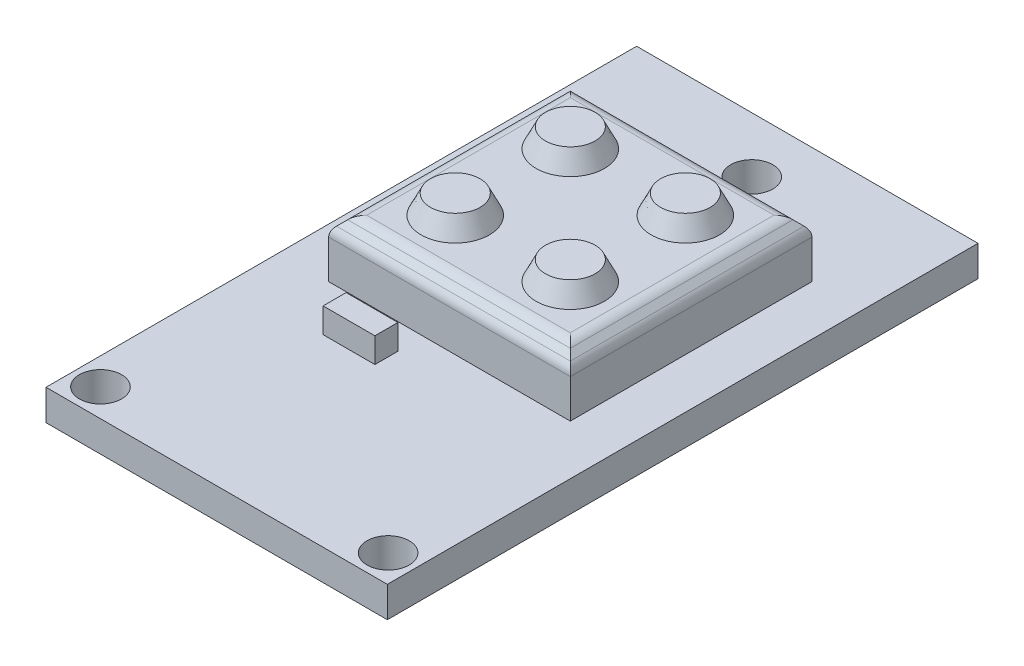
from build123d import *

# Parameters (mm, degrees)
SKETCH1_W           = 12.6
SKETCH1_H           = 12.6
BOSS_EXTRUDE1_DEPTH = 1.3
SKETCH3_R           = 1.29375
BOSS_EXTRUDE3_DEPTH = 2.7
DRAFT1_ANGLE        = 26
SKETCH4_W           = 12.6
SKETCH4_H           = 12.6
BOSS_EXTRUDE4_DEPTH = 1.7
SKETCH5_W           = 17.8
SKETCH5_H           = 30.8
BOSS_EXTRUDE5_DEPTH = 1.6
FILLET1_SIZE        = 0.7
SKETCH7_R           = 1.1
CUT_EXTRUDE1_DEPTH  = 36.933549783
SKETCH8_W           = 2.7
SKETCH8_H           = 1.2
CAPACITOR_DEPTH     = 1.3
FILLET5_R           = 0.7


with BuildPart() as part:
    # Sketch1 → Boss-Extrude1 (new body)
    with BuildSketch(Plane(origin=(0, 0, 0), x_dir=(1, 0, 0), z_dir=(0, 1, 0))):
        with Locations((9, 18.54)):
            Rectangle(SKETCH1_W, SKETCH1_H)
    extrude(amount=BOSS_EXTRUDE1_DEPTH)

    # Sketch3 → Boss-Extrude3 (add)
    with BuildSketch(Plane(origin=(0, 1.3, 0), x_dir=(1, 0, 0), z_dir=(0, 1, 0))):
        with Locations(Location((6, 21.54, 0), (0, 0, 90))):
            Circle(SKETCH3_R)
        with Locations(Location((12, 21.54, 0), (0, 0, 90))):
            Circle(SKETCH3_R)
        with Locations(Location((12, 15.54, 0), (0, 0, 90))):
            Circle(SKETCH3_R)
        with Locations(Location((6, 15.54, 0), (0, 0, 90))):
            Circle(SKETCH3_R)
    extrude(amount=BOSS_EXTRUDE3_DEPTH)

    # Draft1
    draft1_faces = [part.faces().sort_by_distance(p)[0] for p in [
        (6, 2.65, -14.24625),
        (12, 2.65, -14.24625),
        (12, 2.65, -20.24625),
        (6, 2.65, -20.24625),
    ]]
    draft(draft1_faces, Plane(origin=(6, 4, -21.54), x_dir=(0, 0, 1), z_dir=(0, 1, 0)), DRAFT1_ANGLE)

    # Sketch4 → Boss-Extrude4 (add)
    with BuildSketch(Plane(origin=(0, 1.3, 0), x_dir=(1, 0, 0), z_dir=(0, 1, 0))):
        with Locations((9, 18.54)):
            Rectangle(SKETCH4_W, SKETCH4_H)
    extrude(amount=BOSS_EXTRUDE4_DEPTH)

    # Sketch5 → Boss-Extrude5 (add)
    with BuildSketch(Plane.XZ):
        with Locations((9, -15.5)):
            Rectangle(SKETCH5_W, SKETCH5_H)
    extrude(amount=BOSS_EXTRUDE5_DEPTH)

    # Fillet1
    fillet1_edges = [part.edges().sort_by_distance(p)[0] for p in [
        (2.7, 3, -18.54),
        (9, 3, -12.24),
        (15.3, 3, -18.54),
        (9, 3, -24.84),
    ]]
    chamfer(fillet1_edges, length=FILLET1_SIZE)

    # Sketch7 → Cut-Extrude1 (cut, through all)
    with BuildSketch(Plane(origin=(0, 0, 0), x_dir=(1, 0, 0), z_dir=(0, 1, 0))):
        with Locations(Location((1.5, 1.54, 0), (0, 0, 270))):
            Circle(SKETCH7_R)
        with Locations(Location((9, 28, 0), (0, 0, 270))):
            Circle(SKETCH7_R)
        with Locations(Location((16.5, 1.54, 0), (0, 0, 270))):
            Circle(SKETCH7_R)
    extrude(amount=-CUT_EXTRUDE1_DEPTH, mode=Mode.SUBTRACT)

    # Sketch8 → capacitor (add)
    with BuildSketch(Plane(origin=(0, 0, 0), x_dir=(1, 0, 0), z_dir=(0, 1, 0))):
        with Locations((6.3, 10.3)):
            Rectangle(SKETCH8_W, SKETCH8_H)
    extrude(amount=CAPACITOR_DEPTH)

    # Fillet5
    fillet5_edges = [part.edges().sort_by_distance(p)[0] for p in [
        (3.4, 3, -18.54),
        (9, 3, -24.14),
        (14.6, 3, -18.54),
        (9, 3, -12.94),
        (9, 2.3, -12.24),
        (15.3, 2.3, -18.54),
        (9, 2.3, -24.84),
        (2.7, 2.3, -18.54),
    ]]
    fillet(fillet5_edges, radius=FILLET5_R)


solid = part.part
